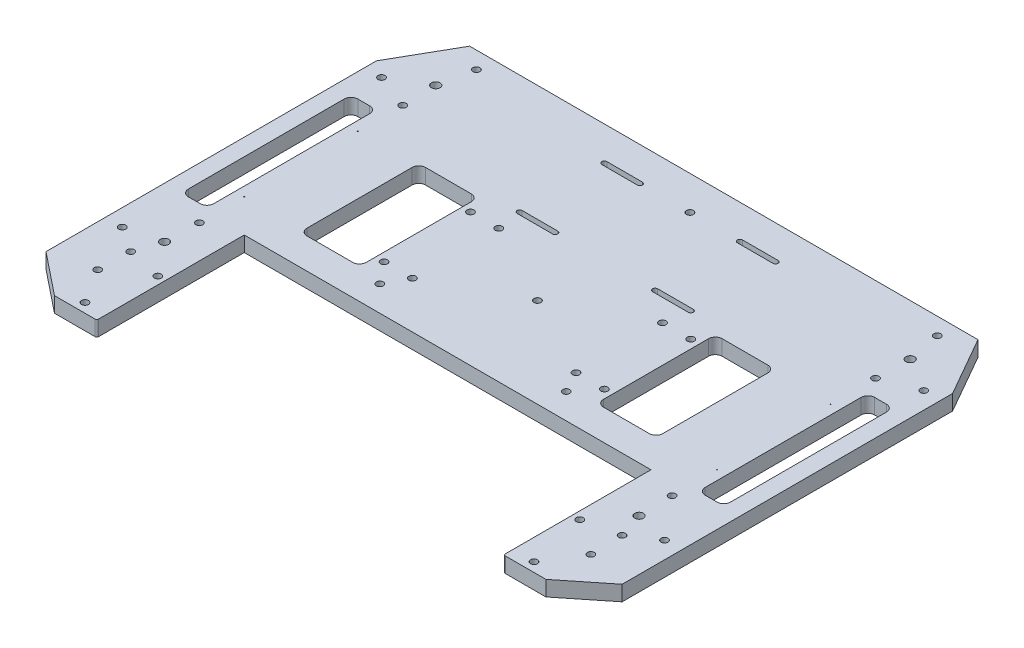
from build123d import *

# Parameters (mm, degrees)
ESQUISSE3_R             = 2.55
STRUCTURE_DEPTH         = 9
ESQUISSE4_R             = 0.25
ENCOCHES_TIGES_DEPTH    = 5
ESQUISSE5_R             = 2.05
ENCODEURS_DEPTH         = 221.410979763
MOTEURS_DEPTH           = 221.410979763
MOTEURS_DEPTH_BACK      = 221.410979763
ESQUISSE6_R             = 2.05
ESQUISSE7_R             = 2.05
PATINS_DEPTH            = 221.410979763
ESQUISSE8_R             = 2.05
ACTIONNEURS_DEPTH       = 221.410979763
CONG_1_R                = 1
BATTERIE_DEPTH          = 30
ESQUISSE10_OUTSIDE_W    = 426.422
ESQUISSE10_OUTSIDE_H    = 336.422
ESQUISSE10_OUTSIDE_R    = 2.05
ESQUISSE10_OUTSIDE_R_2  = 2.55
ENL_V_MAT_EXTRU_1_DEPTH = 10
ESQUISSE11_OUTSIDE_W    = 426.422
ESQUISSE11_OUTSIDE_H    = 336.422
ESQUISSE11_OUTSIDE_R    = 2.05
ENL_V_MAT_EXTRU_2_DEPTH = 10


with BuildPart() as part:
    # Esquisse3 → structure (new body)
    with BuildSketch(Plane(origin=(0, 0, 0), x_dir=(1, 0, 0), z_dir=(0, 1, 0))):
        Polygon((150, 110), (-150, 110), (-170, 75), (-170, 0), (-170, -120), (-145, -140), (-120, -140), (-120, -53), (120, -53), (120, -140), (145, -140), (170, -120), (170, 0), (170, 75), align=None)
        with Locations(Location((-140, 80, 0), (0, 0, 270))):
            Circle(ESQUISSE3_R, mode=Mode.SUBTRACT)
        with Locations(Location((-140, -80, 0), (0, 0, 90))):
            Circle(ESQUISSE3_R, mode=Mode.SUBTRACT)
        with Locations(Location((140, -80, 0), (0, 0, 270))):
            Circle(ESQUISSE3_R, mode=Mode.SUBTRACT)
        with Locations(Location((140, 80, 0), (0, 0, 90))):
            Circle(ESQUISSE3_R, mode=Mode.SUBTRACT)
        with BuildLine():
            Line((-160, -46), (-160, 46))
            ThreePointArc((-160, 46), (-158.828427125, 48.828427125), (-156, 50))
            Line((-156, 50), (-149, 50))
            ThreePointArc((-149, 50), (-146.171572875, 48.828427125), (-145, 46))
            Line((-145, 46), (-145, -46))
            ThreePointArc((-145, -46), (-146.171572875, -48.828427125), (-149, -50))
            Line((-149, -50), (-156, -50))
            ThreePointArc((-156, -50), (-158.828427125, -48.828427125), (-160, -46))
        make_face(mode=Mode.SUBTRACT)
        with BuildLine():
            Line((-105, 0), (-105, 31))
            ThreePointArc((-105, 31), (-103.828427125, 33.828427125), (-101, 35))
            Line((-101, 35), (-74, 35))
            ThreePointArc((-74, 35), (-71.171572875, 33.828427125), (-70, 31))
            Line((-70, 31), (-70, -31))
            ThreePointArc((-70, -31), (-71.171572875, -33.828427125), (-74, -35))
            Line((-74, -35), (-101, -35))
            ThreePointArc((-101, -35), (-103.828427125, -33.828427125), (-105, -31))
            Line((-105, -31), (-105, 0))
        make_face(mode=Mode.SUBTRACT)
        with BuildLine():
            Line((156, 50), (149, 50))
            ThreePointArc((149, 50), (146.171572875, 48.828427125), (145, 46))
            Line((145, 46), (145, -46))
            ThreePointArc((145, -46), (146.171572875, -48.828427125), (149, -50))
            Line((149, -50), (156, -50))
            ThreePointArc((156, -50), (158.828427125, -48.828427125), (160, -46))
            Line((160, -46), (160, 46))
            ThreePointArc((160, 46), (158.828427125, 48.828427125), (156, 50))
        make_face(mode=Mode.SUBTRACT)
        with BuildLine():
            Line((105, 0), (105, 31))
            ThreePointArc((105, 31), (103.828427125, 33.828427125), (101, 35))
            Line((101, 35), (74, 35))
            ThreePointArc((74, 35), (71.171572875, 33.828427125), (70, 31))
            Line((70, 31), (70, -31))
            ThreePointArc((70, -31), (71.171572875, -33.828427125), (74, -35))
            Line((74, -35), (101, -35))
            ThreePointArc((101, -35), (103.828427125, -33.828427125), (105, -31))
            Line((105, -31), (105, 0))
        make_face(mode=Mode.SUBTRACT)
    extrude(amount=-STRUCTURE_DEPTH)

    # Esquisse4 → encoches_tiges (cut)
    with BuildSketch(Plane(origin=(0, 0, 0), x_dir=(1, 0, 0), z_dir=(0, 1, 0))):
        with Locations(Location((-139.5, 33.5, 0), (0, 0, 270))):
            Circle(ESQUISSE4_R)
        with Locations(Location((-139.5, -33.5, 0), (0, 0, 90))):
            Circle(ESQUISSE4_R)
        with Locations(Location((139.5, -33.5, 0), (0, 0, 270))):
            Circle(ESQUISSE4_R)
        with Locations(Location((139.5, 33.5, 0), (0, 0, 90))):
            Circle(ESQUISSE4_R)
    extrude(amount=-ENCOCHES_TIGES_DEPTH, mode=Mode.SUBTRACT)

    # Esquisse5 → encodeurs (cut, through all)
    with BuildSketch(Plane(origin=(0, 0, 0), x_dir=(1, 0, 0), z_dir=(0, 1, 0))):
        with Locations(Location((-139.5, 60, 0), (0, 0, 270))):
            Circle(ESQUISSE5_R)
        with Locations(Location((-139.5, -60, 0), (0, 0, 90))):
            Circle(ESQUISSE5_R)
        with Locations(Location((139.5, -60, 0), (0, 0, 270))):
            Circle(ESQUISSE5_R)
        with Locations(Location((139.5, 60, 0), (0, 0, 90))):
            Circle(ESQUISSE5_R)
    extrude(amount=-ENCODEURS_DEPTH, mode=Mode.SUBTRACT)

    # Esquisse6 → moteurs (cut, two sides: drawn at the far end of the back side and taken through both)
    with BuildSketch(Plane(origin=(0, 0, 0), x_dir=(1, 0, 0), z_dir=(0, 1, 0)).offset(-MOTEURS_DEPTH_BACK)):
        with Locations(Location((-65, 25.5, 0), (0, 0, 270))):
            Circle(ESQUISSE6_R)
        with Locations(Location((-48.3, 25.5, 0), (0, 0, 270))):
            Circle(ESQUISSE6_R)
        with Locations(Location((-65, -25.5, 0), (0, 0, 270))):
            Circle(ESQUISSE6_R)
        with Locations(Location((48.3, -25.5, 0), (0, 0, 270))):
            Circle(ESQUISSE6_R)
        with Locations(Location((65, -25.5, 0), (0, 0, 270))):
            Circle(ESQUISSE6_R)
        with Locations(Location((-48.3, -25.5, 0), (0, 0, 90))):
            Circle(ESQUISSE6_R)
        with Locations(Location((48.3, 25.5, 0), (0, 0, 90))):
            Circle(ESQUISSE6_R)
        with Locations(Location((65, 25.5, 0), (0, 0, 90))):
            Circle(ESQUISSE6_R)
    extrude(amount=MOTEURS_DEPTH + MOTEURS_DEPTH_BACK, mode=Mode.SUBTRACT)

    # Esquisse7 → patins (cut, through all)
    with BuildSketch(Plane(origin=(0, 0, 0), x_dir=(1, 0, 0), z_dir=(0, 1, 0))):
        with Locations(Location((0, 90, 0), (0, 0, 270))):
            Circle(ESQUISSE7_R)
        with Locations(Location((0, 0, 0), (0, 0, 270))):
            Circle(ESQUISSE7_R)
        with Locations(Location((-145, -95, 0), (0, 0, 270))):
            Circle(ESQUISSE7_R)
        with Locations(Location((145, -95, 0), (0, 0, 90))):
            Circle(ESQUISSE7_R)
    extrude(amount=-PATINS_DEPTH, mode=Mode.SUBTRACT)

    # Esquisse8 → actionneurs (cut, through all)
    with BuildSketch(Plane(origin=(0, 0, 0), x_dir=(1, 0, 0), z_dir=(0, 1, 0))):
        with Locations(Location((-132.5, -134.5, 0), (0, 0, 270))):
            Circle(ESQUISSE8_R)
        with Locations(Location((-124.5, -99.5, 0), (0, 0, 270))):
            Circle(ESQUISSE8_R)
        with Locations(Location((132.5, -134.5, 0), (0, 0, 90))):
            Circle(ESQUISSE8_R)
        with Locations(Location((124.5, -99.5, 0), (0, 0, 90))):
            Circle(ESQUISSE8_R)
        with Locations(Location((-145.5, -114, 0), (0, 0, 270))):
            Circle(ESQUISSE8_R)
        with Locations(Location((145.5, -114, 0), (0, 0, 90))):
            Circle(ESQUISSE8_R)
    extrude(amount=-ACTIONNEURS_DEPTH, mode=Mode.SUBTRACT)

    # Congé1
    cong_1_edges = [part.edges().sort_by_distance(p)[0] for p in [
        (-120, -4.5, 140),
        (120, -4.5, 140),
    ]]
    fillet(cong_1_edges, radius=CONG_1_R)

    # Esquisse9 → batterie (cut)
    with BuildSketch(Plane(origin=(0, 0, 0), x_dir=(1, 0, 0), z_dir=(0, 1, 0))):
        with BuildLine():
            ThreePointArc((29.5, 88.5), (28, 90), (29.5, 91.5))
            Line((29.5, 91.5), (50.5, 91.5))
            ThreePointArc((50.5, 91.5), (52, 90), (50.5, 88.5))
            Line((50.5, 88.5), (29.5, 88.5))
        make_face()
        with BuildLine():
            Line((-50.5, 88.5), (-29.5, 88.5))
            ThreePointArc((-29.5, 88.5), (-28, 90), (-29.5, 91.5))
            Line((-29.5, 91.5), (-50.5, 91.5))
            ThreePointArc((-50.5, 91.5), (-52, 90), (-50.5, 88.5))
        make_face()
        with BuildLine():
            Line((-50.5, 38.5), (-29.5, 38.5))
            ThreePointArc((-29.5, 38.5), (-28, 40), (-29.5, 41.5))
            Line((-29.5, 41.5), (-50.5, 41.5))
            ThreePointArc((-50.5, 41.5), (-52, 40), (-50.5, 38.5))
        make_face()
        with BuildLine():
            Line((50.5, 38.5), (29.5, 38.5))
            ThreePointArc((29.5, 38.5), (28, 40), (29.5, 41.5))
            Line((29.5, 41.5), (50.5, 41.5))
            ThreePointArc((50.5, 41.5), (52, 40), (50.5, 38.5))
        make_face()
    extrude(amount=-BATTERIE_DEPTH, mode=Mode.SUBTRACT)

    # Esquisse10 outside → Enlèv. mat.-Extru.1 (cut)
    # profile 1 of 9: a face of its own
    with BuildSketch(Plane(origin=(0, 0, 0), x_dir=(1, 0, 0), z_dir=(0, 1, 0))):
        with Locations((0, -15)):
            Rectangle(ESQUISSE10_OUTSIDE_W, ESQUISSE10_OUTSIDE_H)
        with BuildLine():
            Line((120, -53), (120, -139))
            ThreePointArc((120, -139), (120.292893219, -139.707106781), (121, -140))
            Line((121, -140), (145, -140))
            Line((145, -140), (170, -120))
            Line((170, -120), (170, 75))
            Line((170, 75), (150, 110))
            Line((150, 110), (-150, 110))
            Line((-150, 110), (-170, 75))
            Line((-170, 75), (-170, -120))
            Line((-170, -120), (-145, -140))
            Line((-145, -140), (-121, -140))
            ThreePointArc((-121, -140), (-120.292893219, -139.707106781), (-120, -139))
            Line((-120, -139), (-120, -53))
            Line((-120, -53), (120, -53))
        make_face(mode=Mode.SUBTRACT)
    # profile 2 of 9: a face of its own
    with BuildSketch(Plane(origin=(0, 0, 0), x_dir=(1, 0, 0), z_dir=(0, 1, 0))):
        with Locations(Location((-136, 100, 0), (0, 0, 270))):
            Circle(ESQUISSE10_OUTSIDE_R)
    # profile 3 of 9: a face of its own
    with BuildSketch(Plane(origin=(0, 0, 0), x_dir=(1, 0, 0), z_dir=(0, 1, 0))):
        with Locations(Location((-160, 68, 0), (0, 0, 270))):
            Circle(ESQUISSE10_OUTSIDE_R)
    # profile 4 of 9: a face of its own
    with BuildSketch(Plane(origin=(0, 0, 0), x_dir=(1, 0, 0), z_dir=(0, 1, 0))):
        with Locations(Location((-160, -85, 0), (0, 0, 270))):
            Circle(ESQUISSE10_OUTSIDE_R)
    # profile 5 of 9: a face of its own
    with BuildSketch(Plane(origin=(0, 0, 0), x_dir=(1, 0, 0), z_dir=(0, 1, 0))):
        with Locations(Location((160, -85, 0), (0, 0, 90))):
            Circle(ESQUISSE10_OUTSIDE_R)
    # profile 6 of 9: a face of its own
    with BuildSketch(Plane(origin=(0, 0, 0), x_dir=(1, 0, 0), z_dir=(0, 1, 0))):
        with Locations(Location((160, 68, 0), (0, 0, 90))):
            Circle(ESQUISSE10_OUTSIDE_R)
    # profile 7 of 9: a face of its own
    with BuildSketch(Plane(origin=(0, 0, 0), x_dir=(1, 0, 0), z_dir=(0, 1, 0))):
        with Locations(Location((136, 100, 0), (0, 0, 90))):
            Circle(ESQUISSE10_OUTSIDE_R)
    # profile 8 of 9: a face of its own
    with BuildSketch(Plane(origin=(0, 0, 0), x_dir=(1, 0, 0), z_dir=(0, 1, 0))):
        with Locations(Location((-140, 80, 0), (0, 0, 270))):
            Circle(ESQUISSE10_OUTSIDE_R_2)
    # profile 9 of 9: a face of its own
    with BuildSketch(Plane(origin=(0, 0, 0), x_dir=(1, 0, 0), z_dir=(0, 1, 0))):
        with Locations(Location((-140, -80, 0), (0, 0, 90))):
            Circle(ESQUISSE10_OUTSIDE_R_2)
    extrude(amount=-ENL_V_MAT_EXTRU_1_DEPTH, mode=Mode.SUBTRACT)

    # Esquisse11 outside → Enlèv. mat.-Extru.2 (cut)
    # profile 1 of 3: a face of its own
    with BuildSketch(Plane(origin=(0, 0, 0), x_dir=(1, 0, 0), z_dir=(0, 1, 0))):
        with Locations((0, -15)):
            Rectangle(ESQUISSE11_OUTSIDE_W, ESQUISSE11_OUTSIDE_H)
        with BuildLine():
            Line((120, -53), (120, -139))
            ThreePointArc((120, -139), (120.292893219, -139.707106781), (121, -140))
            Line((121, -140), (145, -140))
            Line((145, -140), (170, -120))
            Line((170, -120), (170, 75))
            Line((170, 75), (150, 110))
            Line((150, 110), (-150, 110))
            Line((-150, 110), (-170, 75))
            Line((-170, 75), (-170, -120))
            Line((-170, -120), (-145, -140))
            Line((-145, -140), (-121, -140))
            ThreePointArc((-121, -140), (-120.292893219, -139.707106781), (-120, -139))
            Line((-120, -139), (-120, -53))
            Line((-120, -53), (120, -53))
        make_face(mode=Mode.SUBTRACT)
    # profile 2 of 3: a face of its own
    with BuildSketch(Plane(origin=(0, 0, 0), x_dir=(1, 0, 0), z_dir=(0, 1, 0))):
        with Locations(Location((-55, -38, 0), (0, 0, 270))):
            Circle(ESQUISSE11_OUTSIDE_R)
    # profile 3 of 3: a face of its own
    with BuildSketch(Plane(origin=(0, 0, 0), x_dir=(1, 0, 0), z_dir=(0, 1, 0))):
        with Locations(Location((55, -38, 0), (0, 0, 90))):
            Circle(ESQUISSE11_OUTSIDE_R)
    extrude(amount=-ENL_V_MAT_EXTRU_2_DEPTH, mode=Mode.SUBTRACT)


solid = part.part
